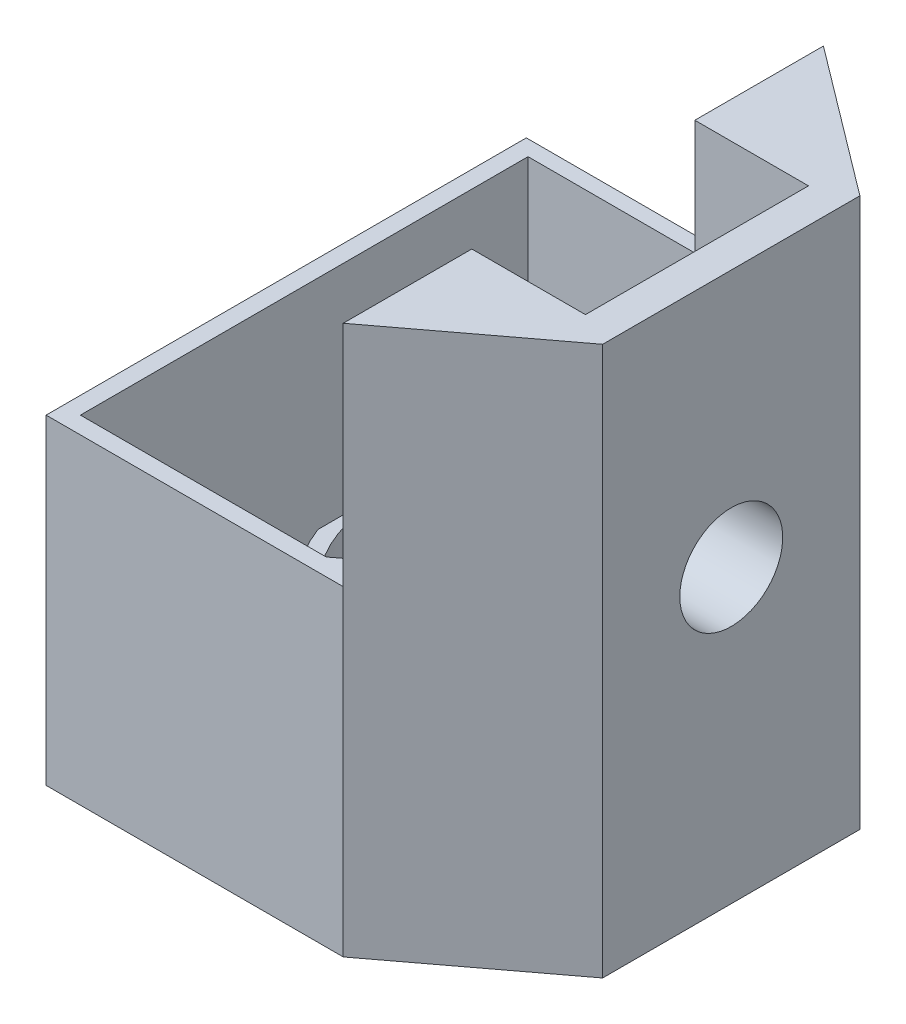
from build123d import *

# Parameters (mm, degrees)
SKETCH1_W           = 20
SKETCH1_H           = 30
BOSS_EXTRUDE1_DEPTH = 2
SKETCH2_R           = 3
CUT_EXTRUDE1_DEPTH  = 2
SKETCH4_W           = 2
SKETCH4_H           = 2.5
CUT_EXTRUDE2_DEPTH  = 32.685959036
BOSS_EXTRUDE2_DEPTH = 30
BOSS_EXTRUDE3_START = 3
SKETCH6_R           = 5
SKETCH6_R_2         = 3
BOSS_EXTRUDE3_DEPTH = 3
BOSS_EXTRUDE4_DEPTH = 2
SKETCH8_W           = 14
SKETCH8_H           = 28
BOSS_EXTRUDE5_DEPTH = 2
SKETCH9_R           = 9.691307823
SKETCH9_R_2         = 8.81055964
BOSS_EXTRUDE6_DEPTH = 4
BOSS_EXTRUDE7_DEPTH = 30
CUT_EXTRUDE3_DEPTH  = 41.577802203
BOSS_EXTRUDE8_DEPTH = 13.3
SKETCH17_W          = 10
SKETCH17_H          = 5
CUT_EXTRUDE5_DEPTH  = 2


with BuildPart() as part:
    # Sketch1 → Boss-Extrude1 (new body)
    with BuildSketch(Plane(origin=(0, 0, 0), x_dir=(0, 0, -1), z_dir=(1, 0, 0))):
        Rectangle(SKETCH1_W, SKETCH1_H)
    extrude(amount=BOSS_EXTRUDE1_DEPTH)

    # Sketch2 → Cut-Extrude1 (cut)
    with BuildSketch(Plane.ZY):
        Circle(SKETCH2_R)
    extrude(amount=-CUT_EXTRUDE1_DEPTH, mode=Mode.SUBTRACT)

    # Sketch4 → Cut-Extrude2 (cut, through all)
    with BuildSketch(Plane(origin=(0, 15, 0), x_dir=(1, 0, 0), z_dir=(0, 1, 0))):
        with Locations((1, 8.75)):
            Rectangle(SKETCH4_W, SKETCH4_H)
        with Locations((1, -8.75)):
            Rectangle(SKETCH4_W, SKETCH4_H)
    extrude(amount=-CUT_EXTRUDE2_DEPTH, mode=Mode.SUBTRACT)

    # Sketch5 → Boss-Extrude2 (add, through all)
    with BuildSketch(Plane(origin=(0, 15, 0), x_dir=(1, 0, 0), z_dir=(0, 1, 0))):
        Polygon((2, 7.5), (-6.625791341, 14), (-9.949071623, 14), (0, 6.502836784), align=None)
        Polygon((-6.625791341, -14), (-9.949071623, -14), (0, -6.502836784), (2, -7.5), align=None)
    extrude(amount=-BOSS_EXTRUDE2_DEPTH)

    # Sketch6 → Boss-Extrude3 (add)
    with BuildSketch(Plane.ZY.offset(BOSS_EXTRUDE3_START)):
        with Locations(Location((0, 0, 0), (0, 0, 180))):
            Circle(SKETCH6_R)
        Circle(SKETCH6_R_2, mode=Mode.SUBTRACT)
    extrude(amount=-BOSS_EXTRUDE3_DEPTH)

    # Sketch7 → Boss-Extrude4 (add)
    with BuildSketch(Plane.XZ.offset(15)):
        Polygon((-9.949071623, 14), (-6.625791341, 14), (2, 7.5), (2, -7.5), (-6.625791341, -14), (-9.949071623, -14), align=None)
    extrude(amount=BOSS_EXTRUDE4_DEPTH)

    # Sketch8 → Boss-Extrude5 (add)
    with BuildSketch(Plane.XZ.offset(17)):
        with Locations((-16.949071623, 0)):
            Rectangle(SKETCH8_W, SKETCH8_H)
    extrude(amount=-BOSS_EXTRUDE5_DEPTH)

    # Sketch9 → Boss-Extrude6 (add)
    with BuildSketch(Plane(origin=(0, -15, 0), x_dir=(1, 0, 0), z_dir=(0, 1, 0))):
        with Locations(Location((-13.884110901, 4.279502294, 0), (0, 0, 90))):
            Circle(SKETCH9_R)
        with Locations(Location((-13.884110901, 4.279502294, 0), (0, 0, 270))):
            Circle(SKETCH9_R_2, mode=Mode.SUBTRACT)
    extrude(amount=BOSS_EXTRUDE6_DEPTH)

    # Sketch10 → Boss-Extrude7 (add)
    with BuildSketch(Plane(origin=(0, -15, 0), x_dir=(1, 0, 0), z_dir=(0, 1, 0))):
        Polygon((-6.625791341, -14), (-6.625791341, -13), (-7.754589709, -13), (-22.949071623, -13), (-22.949071623, 13.1), (-7.754589709, 13.1), (-6.625791341, 13.1), (-6.625791341, 14), (-23.949071623, 14), (-23.949071623, -14), align=None)
    extrude(amount=BOSS_EXTRUDE7_DEPTH)

    # Sketch11 → Cut-Extrude3 (cut, through all)
    with BuildSketch(Plane(origin=(0, 0, -14), x_dir=(-1, 0, 0), z_dir=(0, 0, -1))):
        Polygon((16.934110901, 1.7), (23.949071623, 1.7), (23.949071623, 15), (6.625791341, 15), (6.625791341, 1.7), align=None)
    extrude(amount=-CUT_EXTRUDE3_DEPTH, mode=Mode.SUBTRACT)

    # Sketch13 → Boss-Extrude8 (add)
    with BuildSketch(Plane(origin=(0, 1.7, 0), x_dir=(1, 0, 0), z_dir=(0, 1, 0))):
        Polygon((-6.625791341, -14), (-6.625791341, -6.502836784), (0, -6.502836784), (0, -9.0071081), align=None)
        Polygon((0, 9.0071081), (-6.625791341, 14), (-6.625791341, 6.502836784), (0, 6.502836784), align=None)
    extrude(amount=BOSS_EXTRUDE8_DEPTH)

    # Sketch17 → Cut-Extrude5 (cut)
    with BuildSketch(Plane.XZ.offset(17)):
        with Locations((-14.949071623, 9.5)):
            Rectangle(SKETCH17_W, SKETCH17_H)
    extrude(amount=-CUT_EXTRUDE5_DEPTH, mode=Mode.SUBTRACT)


solid = part.part
